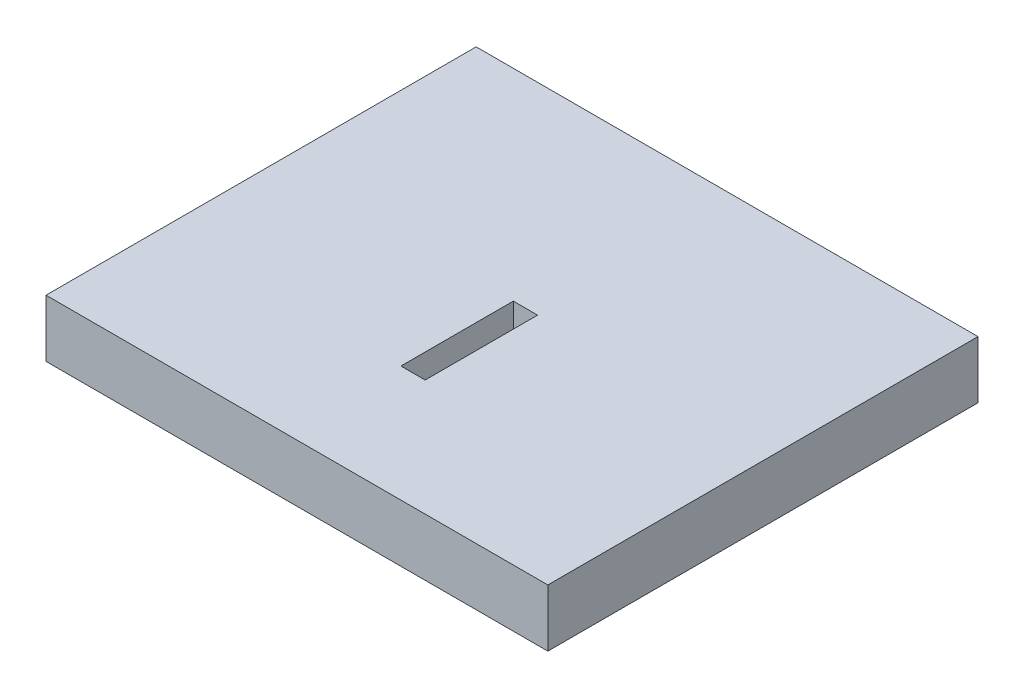
from build123d import *

# Parameters (mm, degrees)
SKETCH1_W           = 35
SKETCH1_H           = 30
SKETCH1_W_2         = 1.691904034
SKETCH1_H_2         = 7.839581069
BOSS_EXTRUDE1_DEPTH = 4


with BuildPart() as part:
    # Sketch1 → Boss-Extrude1 (new body)
    with BuildSketch(Plane(origin=(0, 0, 0), x_dir=(1, 0, 0), z_dir=(0, 1, 0))):
        with Locations((17.5, -15)):
            Rectangle(SKETCH1_W, SKETCH1_H)
        with Locations((17.5, -17.982408881)):
            Rectangle(SKETCH1_W_2, SKETCH1_H_2, mode=Mode.SUBTRACT)
    extrude(amount=BOSS_EXTRUDE1_DEPTH)


solid = part.part
